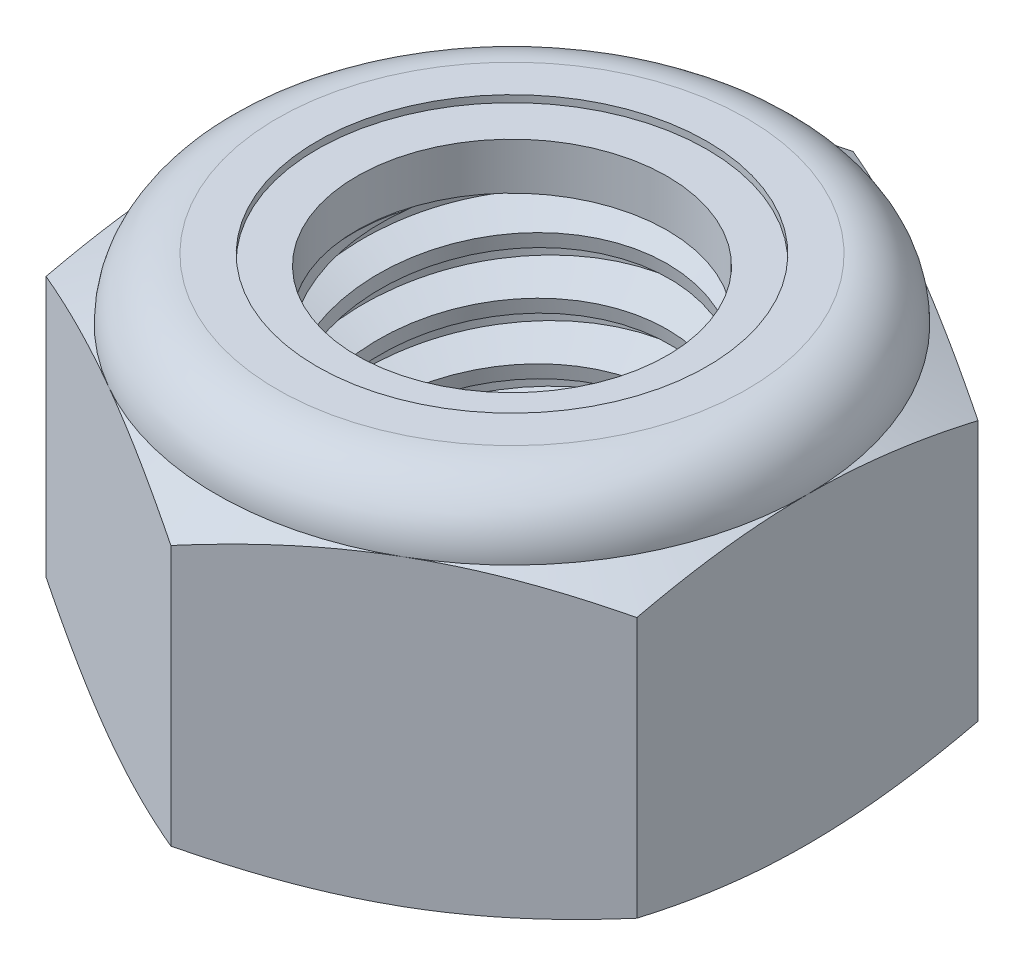
from build123d import *

# Parameters (mm, degrees)
EXTRUDE1_DEPTH      = 8
SKETCH2_W           = 4
SKETCH2_H           = 8
LPATTERN1_COUNT     = 6
LPATTERN1_PITCH     = 1.25
LPATTERN1_COL_COUNT = 2
LPATTERN1_COL_PITCH = 1.25


with BuildPart() as part:
    # Sketch1 → Extrude1 (new body)
    with BuildSketch(Plane(origin=(0, 0, 0), x_dir=(1, 0, 0), z_dir=(0, 1, 0))):
        Polygon((0, 7.505553499), (-6.5, 3.75277675), (-6.5, -3.75277675), (0, -7.505553499), (6.5, -3.75277675), (6.5, 3.75277675), align=None)
    extrude(amount=EXTRUDE1_DEPTH)

    # Sketch4 → Cut-Revolve2 (revolve, cut)
    with BuildSketch(Plane(origin=(0, 0, 0), x_dir=(0, 0, -1), z_dir=(1, 0, 0)), mode=Mode.PRIVATE) as cut_revolve2_sk:
        Polygon((0, 8), (4, 8), (3.415953356, 7.727654577), (3.415953356, 0.272345423), (4, 0), (0, 0), align=None)
    revolve(cut_revolve2_sk.sketch.rotate(Axis((0, 8, 0), (0, 1, 0)), 55.056269787), axis=Axis((0, 8, 0), (0, 1, 0)), mode=Mode.SUBTRACT)


with BuildPart() as body_2:
    # Sketch2 → Revolve1 (revolve)
    with BuildSketch(Plane(origin=(0, 0, 0), x_dir=(0, 0, -1), z_dir=(1, 0, 0))):
        with Locations((2, 4)):
            Rectangle(SKETCH2_W, SKETCH2_H)
    revolve(axis=Axis((0, -4, 0), (0, 1, 0)))

    # Sketch3 → Cut-Revolve1 (revolve, cut)
    with BuildSketch(Plane(origin=(0, 0, 0), x_dir=(0, 0, -1), z_dir=(1, 0, 0)), mode=Mode.PRIVATE) as cut_revolve1_sk:
        Polygon((4.024121388, 7.84562312), (4.1929711, 6.764984958), (3.464196131, 7.046478487), (3.415953356, 7.355232247), align=None)
    cut_revolve1 = revolve(cut_revolve1_sk.sketch.rotate(Axis((0, 8, 0.208852549), (0, -0.9880120337511015, -0.15437688027360996)), 180), axis=Axis((0, 8, 0.208852549), (0, -0.9880120337511015, -0.15437688027360996)), mode=Mode.SUBTRACT)

    # LPattern1: Cut-Revolve1 ×6
    with Locations(*[(0, -i * LPATTERN1_PITCH, 0) for i in range(1, LPATTERN1_COUNT)]):
        add(cut_revolve1, mode=Mode.SUBTRACT)

    # LPattern1 col: Cut-Revolve1 ×2
    with Locations(*[(0, i * LPATTERN1_COL_PITCH, 0) for i in range(1, LPATTERN1_COL_COUNT)]):
        add(cut_revolve1, mode=Mode.SUBTRACT)


with BuildPart() as part_1:
    add(part.part)

    # Combine1: cut body 2
    add(body_2.part, mode=Mode.SUBTRACT)

    # Sketch5 → Cut-Revolve3 (revolve, cut)
    with BuildSketch(Plane(origin=(0, 0, 0), x_dir=(0, 0, -1), z_dir=(1, 0, 0)), mode=Mode.PRIVATE) as cut_revolve3_sk:
        with BuildLine():
            Line((0, 0), (6.5, 0))
            Line((6.5, 0), (7.505553499, 0.468897297))
            Line((7.505553499, 0.468897297), (7.505553499, 6.197769369))
            Line((7.505553499, 6.197769369), (6.5, 6.666666667))
            ThreePointArc((6.5, 6.666666667), (6.109475708, 7.609475708), (5.166666667, 8))
            Line((5.166666667, 8), (5.166666667, 9.27))
            Line((5.166666667, 9.27), (8.775553499, 9.27))
            Line((8.775553499, 9.27), (8.775553499, -1.27))
            Line((8.775553499, -1.27), (0, -1.27))
            Line((0, -1.27), (0, 0))
        make_face()
    revolve(cut_revolve3_sk.sketch.rotate(Axis((0, 0, 0), (0, 1, 0)), 55.056269787), axis=Axis((0, 0, 0), (0, 1, 0)), mode=Mode.SUBTRACT)

    # Sketch6 → Cut-Revolve4 (revolve, cut)
    with BuildSketch(Plane(origin=(0, 0, 0), x_dir=(0, 0, -1), z_dir=(1, 0, 0))):
        with BuildLine():
            Line((0, 6.666666667), (6.3476, 6.666666667))
            ThreePointArc((6.3476, 6.666666667), (6.001712635, 7.501712635), (5.166666667, 7.8476))
            Line((5.166666667, 7.8476), (4.291310011, 7.8476))
            Line((4.291310011, 7.8476), (4.291310011, 9.27))
            Line((4.291310011, 9.27), (0, 9.27))
            Line((0, 9.27), (0, 6.666666667))
        make_face()
    revolve(axis=Axis((0, 9.27, 0), (0, 1, 0)), mode=Mode.SUBTRACT)


with BuildPart() as body_2_2:
    # Sketch7 → Revolve2 (revolve)
    with BuildSketch(Plane(origin=(0, 0, 0), x_dir=(0, 0, -1), z_dir=(1, 0, 0))):
        with BuildLine():
            Line((3.415953356, 6.742866667), (6.268768884, 6.742866667))
            ThreePointArc((6.268768884, 6.742866667), (5.920409016, 7.474322663), (5.166666667, 7.7714))
            Line((5.166666667, 7.7714), (3.415953356, 7.7714))
            Line((3.415953356, 7.7714), (3.415953356, 6.742866667))
        make_face()
    revolve(axis=Axis((0, 6.742866667, 0), (0, 1, 0)))


solid = Compound([part_1.part, body_2_2.part])
